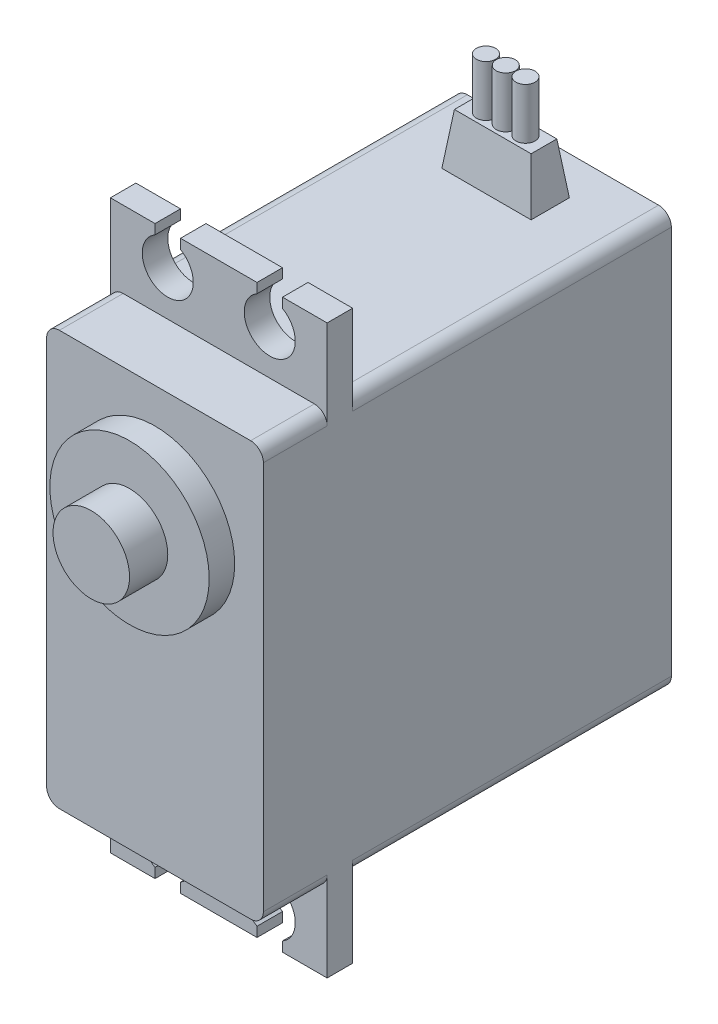
from build123d import *

# Parameters (mm, degrees)
SKETCH1_W           = 32.5
SKETCH1_H           = 17
BOSS_EXTRUDE1_DEPTH = 32
BOSS_EXTRUDE2_START = -5
BOSS_EXTRUDE2_DEPTH = 2
SKETCH3_R           = 6.25
BOSS_EXTRUDE3_DEPTH = 2
SKETCH4_R           = 3
BOSS_EXTRUDE4_DEPTH = 3
SKETCH5_W           = 7
SKETCH5_H           = 3
BOSS_EXTRUDE5_DEPTH = 4
BOSS_EXTRUDE5_TAPER = 7
SKETCH6_R           = 0.75
BOSS_EXTRUDE6_DEPTH = 4
FILLET1_R           = 1


with BuildPart() as part:
    # Sketch1 → Boss-Extrude1 (new body)
    with BuildSketch(Plane(origin=(0, 0, 0), x_dir=(0, 1, 0), z_dir=(0, 0, 1))):
        Rectangle(SKETCH1_W, SKETCH1_H)
    extrude(amount=BOSS_EXTRUDE1_DEPTH)

    # Sketch2 → Boss-Extrude2 (add)
    with BuildSketch(Plane.XY.offset(32).offset(BOSS_EXTRUDE2_START)):
        with BuildLine():
            Line((-8.5, 16.25), (8.5, 16.25))
            Line((8.5, 16.25), (8.5, 22.25))
            Line((8.5, 22.25), (5, 22.25))
            Line((5, 22.25), (5, 21.482050808))
            ThreePointArc((5, 21.482050808), (4, 17.75), (3, 21.482050808))
            Line((3, 21.482050808), (3, 22.25))
            Line((3, 22.25), (-3, 22.25))
            Line((-3, 22.25), (-3, 21.482050808))
            ThreePointArc((-3, 21.482050808), (-4, 17.75), (-5, 21.482050808))
            Line((-5, 21.482050808), (-5, 22.25))
            Line((-5, 22.25), (-8.5, 22.25))
            Line((-8.5, 22.25), (-8.5, 16.25))
        make_face()
        with BuildLine():
            Line((8.5, -16.25), (8.5, -22.25))
            Line((8.5, -22.25), (5, -22.25))
            Line((5, -22.25), (5, -21.482050808))
            ThreePointArc((5, -21.482050808), (4, -17.75), (3, -21.482050808))
            Line((3, -21.482050808), (3, -22.25))
            Line((3, -22.25), (-3, -22.25))
            Line((-3, -22.25), (-3, -21.482050808))
            ThreePointArc((-3, -21.482050808), (-4, -17.75), (-5, -21.482050808))
            Line((-5, -21.482050808), (-5, -22.25))
            Line((-5, -22.25), (-8.5, -22.25))
            Line((-8.5, -22.25), (-8.5, -16.25))
            Line((-8.5, -16.25), (8.5, -16.25))
        make_face()
    extrude(amount=-BOSS_EXTRUDE2_DEPTH)

    # Sketch3 → Boss-Extrude3 (add)
    with BuildSketch(Plane.XY.offset(32)):
        with Locations((0, 7.25)):
            Circle(SKETCH3_R)
    extrude(amount=BOSS_EXTRUDE3_DEPTH)

    # Sketch4 → Boss-Extrude4 (add)
    with BuildSketch(Plane.XY.offset(34)):
        with Locations((0, 7.25)):
            Circle(SKETCH4_R)
    extrude(amount=BOSS_EXTRUDE4_DEPTH)

    # Sketch5 → Boss-Extrude5 (add)
    with BuildSketch(Plane(origin=(0, 16.25, 0), x_dir=(-1, 0, 0), z_dir=(0, 1, 0))):
        with Locations((0, 4.5)):
            Rectangle(SKETCH5_W, SKETCH5_H)
    extrude(amount=BOSS_EXTRUDE5_DEPTH, taper=BOSS_EXTRUDE5_TAPER)

    # Sketch6 → Boss-Extrude6 (add)
    with BuildSketch(Plane(origin=(0, 20.25, 0), x_dir=(-1, 0, 0), z_dir=(0, 1, 0))):
        with Locations(Location((0, 4.488737184, 0), (0, 0, 90))):
            Circle(SKETCH6_R)
        with Locations(Location((1.55, 4.488737184, 0), (0, 0, 90))):
            Circle(SKETCH6_R)
        with Locations(Location((-1.55, 4.488737184, 0), (0, 0, 90))):
            Circle(SKETCH6_R)
    extrude(amount=BOSS_EXTRUDE6_DEPTH)

    # Fillet1
    fillet1_edges = [part.edges().sort_by_distance(p)[0] for p in [
        (8.5, -16.25, 12.5),
        (-8.5, -16.25, 12.5),
        (-8.5, 16.25, 12.5),
        (8.5, 16.25, 12.5),
        (8.5, 16.25, 29.5),
        (8.5, -16.25, 29.5),
        (-8.5, -16.25, 29.5),
        (-8.5, 16.25, 29.5),
    ]]
    fillet(fillet1_edges, radius=FILLET1_R)


solid = part.part
